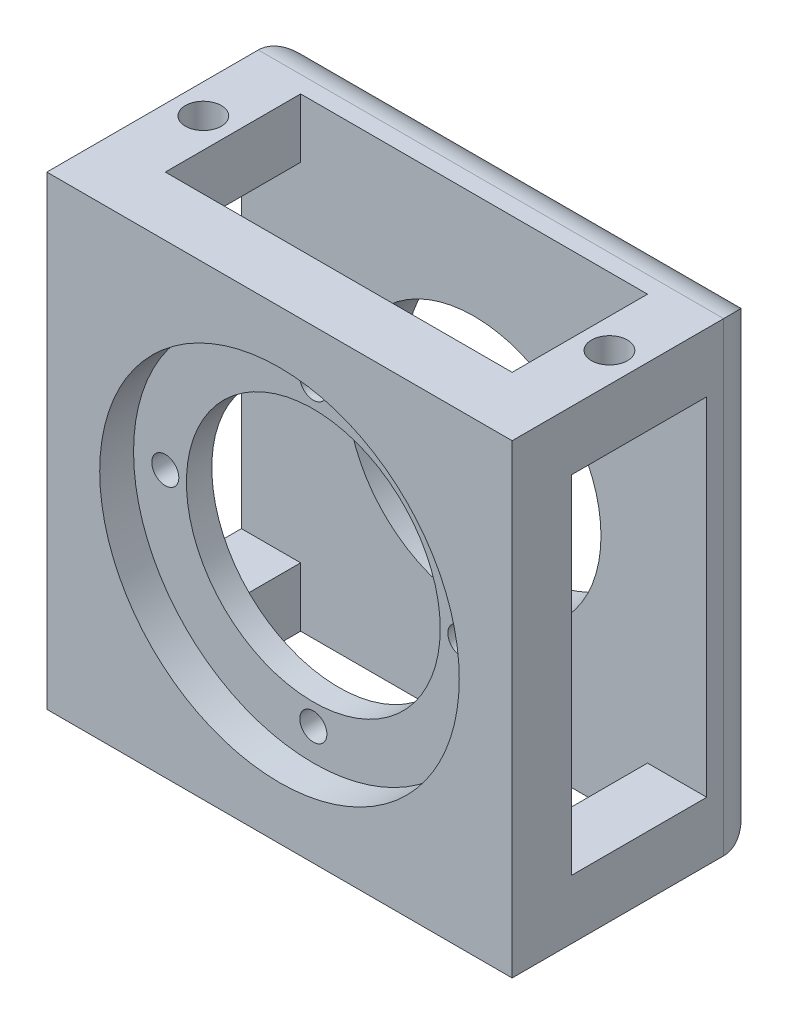
from build123d import *

# Parameters (mm, degrees)
SKETCH1_W           = 55
SKETCH1_H           = 55
BOSS_EXTRUDE1_DEPTH = 30
SKETCH4_W           = 41
SKETCH4_H           = 16
CUT_EXTRUDE1_DEPTH  = 69.419660917
SKETCH5_W           = 16
SKETCH5_H           = 41
CUT_EXTRUDE2_DEPTH  = 60
SKETCH7_R           = 21.25
CUT_EXTRUDE3_DEPTH  = 4
SKETCH8_R           = 15
CUT_EXTRUDE4_DEPTH  = 50
SKETCH9_R           = 1.6
CUT_EXTRUDE5_DEPTH  = 10
SKETCH11_R          = 2.125
CUT_EXTRUDE6_DEPTH  = 10
FILLET2_R           = 5


with BuildPart() as part:
    # Sketch1 → Boss-Extrude1 (new body)
    with BuildSketch(Plane.XY):
        Rectangle(SKETCH1_W, SKETCH1_H)
    extrude(amount=BOSS_EXTRUDE1_DEPTH)

    # Sketch4 → Cut-Extrude1 (cut, through all)
    with BuildSketch(Plane(origin=(0, 27.5, 0), x_dir=(1, 0, 0), z_dir=(0, 1, 0))):
        with Locations((0, -15)):
            Rectangle(SKETCH4_W, SKETCH4_H)
    extrude(amount=-CUT_EXTRUDE1_DEPTH, mode=Mode.SUBTRACT)

    # Sketch5 → Cut-Extrude2 (cut)
    with BuildSketch(Plane(origin=(27.5, 0, 0), x_dir=(0, 0, -1), z_dir=(1, 0, 0))):
        with Locations((-15, 0)):
            Rectangle(SKETCH5_W, SKETCH5_H)
    extrude(amount=-CUT_EXTRUDE2_DEPTH, mode=Mode.SUBTRACT)

    # Sketch7 → Cut-Extrude3 (cut)
    with BuildSketch(Plane.XY.offset(30)):
        Circle(SKETCH7_R)
    extrude(amount=-CUT_EXTRUDE3_DEPTH, mode=Mode.SUBTRACT)

    # Sketch8 → Cut-Extrude4 (cut)
    with BuildSketch(Plane.XY.offset(26)):
        Circle(SKETCH8_R)
    extrude(amount=-CUT_EXTRUDE4_DEPTH, mode=Mode.SUBTRACT)

    # Sketch9 → Cut-Extrude5 (cut)
    with BuildSketch(Plane.XY.offset(26)):
        with Locations((0, 17.5)):
            Circle(SKETCH9_R)
        with Locations((17.5, 0)):
            Circle(SKETCH9_R)
        with Locations((0, -17.5)):
            Circle(SKETCH9_R)
        with Locations((-17.5, 0)):
            Circle(SKETCH9_R)
    extrude(amount=-CUT_EXTRUDE5_DEPTH, mode=Mode.SUBTRACT)

    # Sketch11 → Cut-Extrude6 (cut)
    with BuildSketch(Plane(origin=(0, 27.5, 0), x_dir=(1, 0, 0), z_dir=(0, 1, 0))):
        with Locations(Location((-24, -15, 0), (0, 0, 180))):
            Circle(SKETCH11_R)
        with Locations(Location((24, -15, 0), (0, 0, 180))):
            Circle(SKETCH11_R)
    extrude(amount=-CUT_EXTRUDE6_DEPTH, mode=Mode.SUBTRACT)

    # Fillet2
    fillet2_edges = [part.edges().sort_by_distance(p)[0] for p in [
        (0, 27.5, 0),
        (27.5, 0, 0),
        (0, -27.5, 0),
        (-27.5, 0, 0),
    ]]
    fillet(fillet2_edges, radius=FILLET2_R)


solid = part.part
